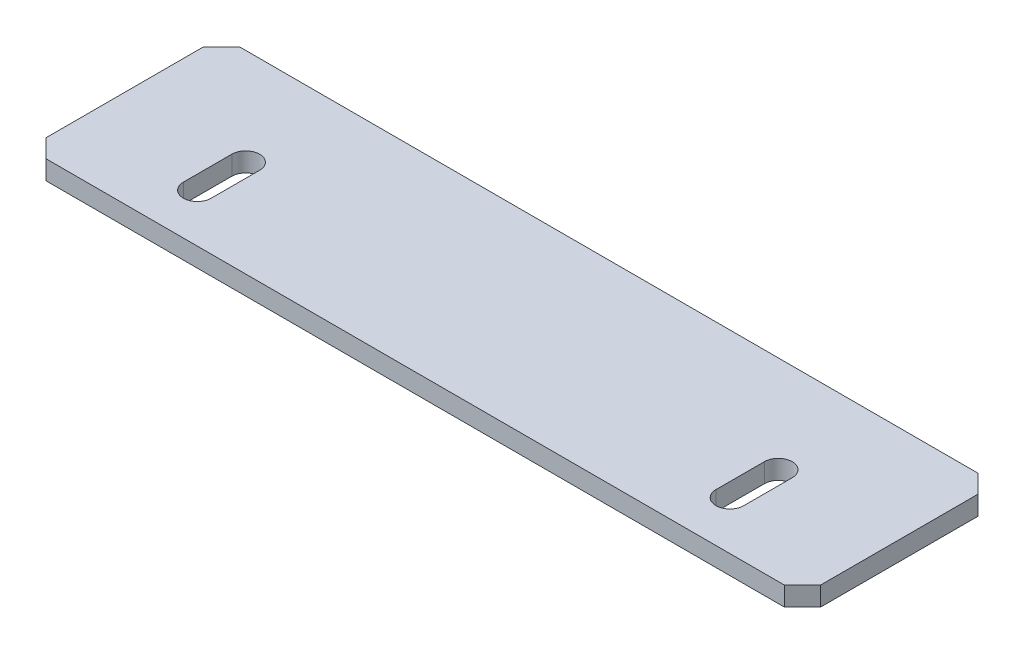
from build123d import *

# Parameters (mm, degrees)
BOSS_EXTRUDE1_DEPTH = 7.9


with BuildPart() as part:
    # Sketch1 → Boss-Extrude1 (new, symmetric)
    with BuildSketch(Plane(origin=(0, 0, 0), x_dir=(1, 0, 0), z_dir=(0, 1, 0))):
        Polygon((-320, 65), (-305, 80), (305, 80), (320, 65), (320, -65), (305, -80), (-305, -80), (-320, -65), align=None)
        with BuildLine():
            Line((208.5, -40), (208.5, 0))
            ThreePointArc((208.5, 0), (220, 11.5), (231.5, 0))
            Line((231.5, 0), (231.5, -40))
            ThreePointArc((231.5, -40), (220, -51.5), (208.5, -40))
        make_face(mode=Mode.SUBTRACT)
        with BuildLine():
            Line((-208.5, -40), (-208.5, 0))
            ThreePointArc((-208.5, 0), (-220, 11.5), (-231.5, 0))
            Line((-231.5, 0), (-231.5, -40))
            ThreePointArc((-231.5, -40), (-220, -51.5), (-208.5, -40))
        make_face(mode=Mode.SUBTRACT)
    extrude(amount=BOSS_EXTRUDE1_DEPTH, both=True)


solid = part.part
